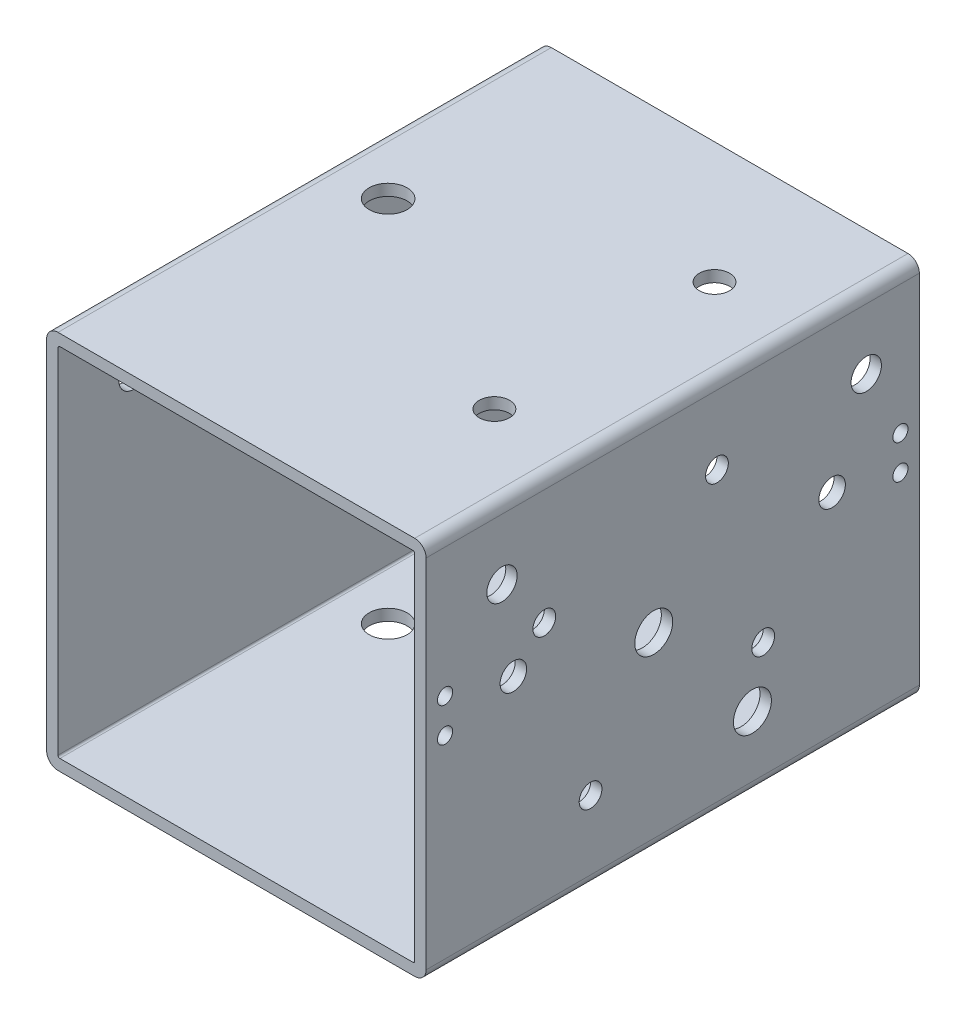
from build123d import *

# Parameters (mm, degrees)
SKETCH1_W                      = 100
SKETCH1_H                      = 100
SKETCH1_W_2                    = 94
SKETCH1_H_2                    = 94
EXTRUDE_THIN1_DEPTH            = 130
FILLET1_R                      = 0.5
FILLET2_R                      = 3
F_8_0_8_DIAMETER_HOLE2_D       = 8
F_8_0_8_DIAMETER_HOLE3_D       = 8
F_10_0_10_DIAMETER_HOLE1_D     = 10
F_10_0_10_DIAMETER_HOLE2_D     = 10
M8X1_25_TAPPED_HOLE1_D         = 6.8
M8X1_25_TAPPED_HOLE1_DEPTH     = 3
M8X1_25_TAPPED_HOLE2_D         = 6.8
M8X1_25_TAPPED_HOLE2_DEPTH     = 3
F_10_0_10_DIAMETER_HOLE3_D     = 10
F_10_0_10_DIAMETER_HOLE3_DEPTH = 3
F_6_0_6_DIAMETER_HOLE1_D       = 6
F_6_0_6_DIAMETER_HOLE1_DEPTH   = 3
CUT_EXTRUDE1_REACH             = 173.464
SKETCH27_R                     = 2
SKETCH27_R_2                   = 3.5


with BuildPart() as part:
    # Sketch1 → Extrude-Thin1 (new body)
    with BuildSketch(Plane.XY):
        Rectangle(SKETCH1_W, SKETCH1_H)
        Rectangle(SKETCH1_W_2, SKETCH1_H_2, mode=Mode.SUBTRACT)
    extrude(amount=EXTRUDE_THIN1_DEPTH)

    # Fillet1
    fillet1_edges = [part.edges().sort_by_distance(p)[0] for p in [
        (47, -47, 65),
        (47, 47, 65),
        (-47, 47, 65),
        (-47, -47, 65),
    ]]
    fillet(fillet1_edges, radius=FILLET1_R)

    # Fillet2
    fillet2_edges = [part.edges().sort_by_distance(p)[0] for p in [
        (50, -50, 65),
        (-50, -50, 65),
        (-50, 50, 65),
        (50, 50, 65),
    ]]
    fillet(fillet2_edges, radius=FILLET2_R)

    # Ø8.0 (8) Diameter Hole2 (through all)
    with Locations(Plane(origin=(0, 50, 0), x_dir=(1, 0, 0), z_dir=(0, 1, 0))):
        with Locations((28, -32), (28, -90)):
            Hole(F_8_0_8_DIAMETER_HOLE2_D / 2)

    # Ø8.0 (8) Diameter Hole3 (through all)
    with Locations(Plane(origin=(50, 0, 0), x_dir=(0, 0, -1), z_dir=(1, 0, 0))):
        with Locations((-14, 31), (-110, 31)):
            Hole(F_8_0_8_DIAMETER_HOLE3_D / 2)

    # Ø10.0 (10) Diameter Hole1 (through all)
    with Locations(Plane(origin=(0, 50, 0), x_dir=(1, 0, 0), z_dir=(0, 1, 0))):
        with Locations((-34, -56)):
            Hole(F_10_0_10_DIAMETER_HOLE1_D / 2)

    # Ø10.0 (10) Diameter Hole2 (through all)
    with Locations(Plane(origin=(50, 0, 0), x_dir=(0, 0, -1), z_dir=(1, 0, 0))):
        with Locations((-44, -31)):
            Hole(F_10_0_10_DIAMETER_HOLE2_D / 2)

    # M8x1.25 Tapped Hole1
    with Locations(Plane.ZY.offset(50)):
        with Locations((56, -15), (56, 35)):
            Hole(M8X1_25_TAPPED_HOLE1_D / 2, depth=M8X1_25_TAPPED_HOLE1_DEPTH)

    # M8x1.25 Tapped Hole2
    with Locations(Plane(origin=(0, -50, 0), x_dir=(-1, 0, 0), z_dir=(0, -1, 0))):
        with Locations((20, -44), (-35, -44)):
            Hole(M8X1_25_TAPPED_HOLE2_D / 2, depth=M8X1_25_TAPPED_HOLE2_DEPTH)

    # Ø10.0 (10) Diameter Hole3
    with Locations(Plane(origin=(50, 0, 0), x_dir=(0, 0, -1), z_dir=(1, 0, 0))):
        with Locations((-70, 0)):
            Hole(F_10_0_10_DIAMETER_HOLE3_D / 2, depth=F_10_0_10_DIAMETER_HOLE3_DEPTH)

    # Ø6.0 (6) Diameter Hole1
    with Locations(Plane(origin=(50, 0, 0), x_dir=(0, 0, -1), z_dir=(1, 0, 0))):
        with Locations((-41.157258279, -16.652364697), (-53.347635303, 28.842741721), (-98.842741721, 16.652364697), (-86.652364697, -28.842741721)):
            Hole(F_6_0_6_DIAMETER_HOLE1_D / 2, depth=F_6_0_6_DIAMETER_HOLE1_DEPTH)

    # Sketch27 → Cut-Extrude1 (cut, up to next)
    with BuildSketch(Plane(origin=(50, 0, 0), x_dir=(0, 0, -1), z_dir=(1, 0, 0)), mode=Mode.PRIVATE) as cut_extrude1_sk1:
        with Locations(Location((-5, 13, 0), (0, 0, 90))):
            Circle(SKETCH27_R)
    cut_extrude1_tool1 = extrude(cut_extrude1_sk1.sketch, amount=-CUT_EXTRUDE1_REACH, mode=Mode.PRIVATE) & part.part
    # Sketch27 → Cut-Extrude1 (cut, up to next)
    with BuildSketch(Plane(origin=(50, 0, 0), x_dir=(0, 0, -1), z_dir=(1, 0, 0)), mode=Mode.PRIVATE) as cut_extrude1_sk2:
        with Locations(Location((-5, 4, 0), (0, 0, 90))):
            Circle(SKETCH27_R)
    cut_extrude1_tool2 = extrude(cut_extrude1_sk2.sketch, amount=-CUT_EXTRUDE1_REACH, mode=Mode.PRIVATE) & part.part
    # Sketch27 → Cut-Extrude1 (cut, up to next)
    with BuildSketch(Plane(origin=(50, 0, 0), x_dir=(0, 0, -1), z_dir=(1, 0, 0)), mode=Mode.PRIVATE) as cut_extrude1_sk3:
        with Locations(Location((-23, 8.5, 0), (0, 0, 90))):
            Circle(SKETCH27_R_2)
    cut_extrude1_tool3 = extrude(cut_extrude1_sk3.sketch, amount=-CUT_EXTRUDE1_REACH, mode=Mode.PRIVATE) & part.part
    # Sketch27 → Cut-Extrude1 (cut, up to next)
    with BuildSketch(Plane(origin=(50, 0, 0), x_dir=(0, 0, -1), z_dir=(1, 0, 0)), mode=Mode.PRIVATE) as cut_extrude1_sk4:
        with Locations(Location((-107, 8.5, 0), (0, 0, 270))):
            Circle(SKETCH27_R_2)
    cut_extrude1_tool4 = extrude(cut_extrude1_sk4.sketch, amount=-CUT_EXTRUDE1_REACH, mode=Mode.PRIVATE) & part.part
    # Sketch27 → Cut-Extrude1 (cut, up to next)
    with BuildSketch(Plane(origin=(50, 0, 0), x_dir=(0, 0, -1), z_dir=(1, 0, 0)), mode=Mode.PRIVATE) as cut_extrude1_sk5:
        with Locations(Location((-125, 4, 0), (0, 0, 270))):
            Circle(SKETCH27_R)
    cut_extrude1_tool5 = extrude(cut_extrude1_sk5.sketch, amount=-CUT_EXTRUDE1_REACH, mode=Mode.PRIVATE) & part.part
    # Sketch27 → Cut-Extrude1 (cut, up to next)
    with BuildSketch(Plane(origin=(50, 0, 0), x_dir=(0, 0, -1), z_dir=(1, 0, 0)), mode=Mode.PRIVATE) as cut_extrude1_sk6:
        with Locations(Location((-125, 13, 0), (0, 0, 270))):
            Circle(SKETCH27_R)
    cut_extrude1_tool6 = extrude(cut_extrude1_sk6.sketch, amount=-CUT_EXTRUDE1_REACH, mode=Mode.PRIVATE) & part.part
    add(cut_extrude1_tool1.solids().sort_by_distance((50, 13, 5))[0], mode=Mode.SUBTRACT)
    add(cut_extrude1_tool2.solids().sort_by_distance((50, 4, 5))[0], mode=Mode.SUBTRACT)
    add(cut_extrude1_tool3.solids().sort_by_distance((50, 8.5, 23))[0], mode=Mode.SUBTRACT)
    add(cut_extrude1_tool4.solids().sort_by_distance((50, 8.5, 107))[0], mode=Mode.SUBTRACT)
    add(cut_extrude1_tool5.solids().sort_by_distance((50, 4, 125))[0], mode=Mode.SUBTRACT)
    add(cut_extrude1_tool6.solids().sort_by_distance((50, 13, 125))[0], mode=Mode.SUBTRACT)


solid = part.part
